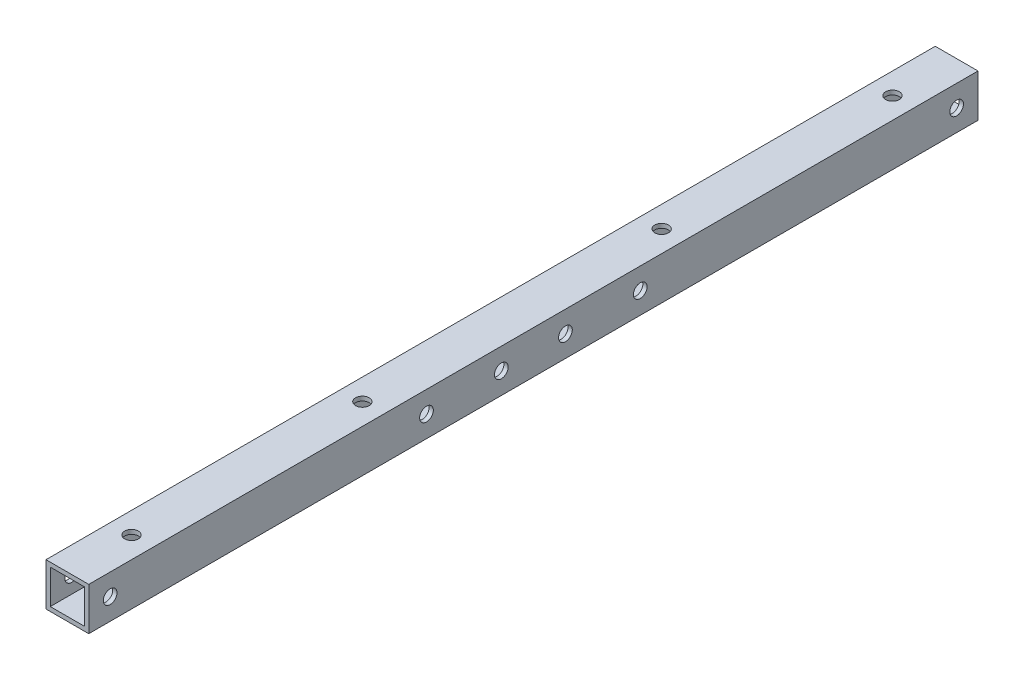
from build123d import *

# Parameters (mm, degrees)
SKETCH_1_W          = 10
SKETCH_1_H          = 10
SKETCH_1_W_2        = 8
SKETCH_1_H_2        = 8
EXTRUDE_1_DEPTH     = 208
SKETCH_2_R          = 1.6
CUT_EXTRUDE_1_DEPTH = 209.300264042
SKETCH_3_R          = 1.6
CUT_EXTRUDE_2_DEPTH = 209.300264042
SKETCH_4_R          = 1.6
CUT_EXTRUDE_3_DEPTH = 209.300264042
SKETCH_5_R          = 1.6
CUT_EXTRUDE_4_DEPTH = 209.300264042


with BuildPart() as part:
    # ｽｹｯﾁ1 → ﾎﾞｽ - 押し出し1 (new body)
    with BuildSketch(Plane.XY):
        Rectangle(SKETCH_1_W, SKETCH_1_H)
        Rectangle(SKETCH_1_W_2, SKETCH_1_H_2, mode=Mode.SUBTRACT)
    extrude(amount=EXTRUDE_1_DEPTH)

    # ｽｹｯﾁ2 → ｶｯﾄ - 押し出し1 (cut, through all)
    with BuildSketch(Plane(origin=(5, 0, 0), x_dir=(0, 0, -1), z_dir=(1, 0, 0))):
        with Locations(Location((-203, 0, 0), (0, 0, 90))):
            Circle(SKETCH_2_R)
        with Locations(Location((-111.5, 0, 0), (0, 0, 90))):
            Circle(SKETCH_2_R)
        with Locations(Location((-96.5, 0, 0), (0, 0, 90))):
            Circle(SKETCH_2_R)
        with Locations(Location((-5, 0, 0), (0, 0, 90))):
            Circle(SKETCH_2_R)
    extrude(amount=-CUT_EXTRUDE_1_DEPTH, mode=Mode.SUBTRACT)

    # ｽｹｯﾁ3 → ｶｯﾄ - 押し出し2 (cut, through all)
    with BuildSketch(Plane(origin=(0, 5, 0), x_dir=(1, 0, 0), z_dir=(0, 1, 0))):
        with Locations(Location((0, -193, 0), (0, 0, 270))):
            Circle(SKETCH_3_R)
        with Locations(Location((0, -15, 0), (0, 0, 270))):
            Circle(SKETCH_3_R)
    extrude(amount=-CUT_EXTRUDE_2_DEPTH, mode=Mode.SUBTRACT)

    # ｽｹｯﾁ4 → ｶｯﾄ - 押し出し3 (cut, through all)
    with BuildSketch(Plane(origin=(5, 0, 0), x_dir=(0, 0, -1), z_dir=(1, 0, 0))):
        with Locations(Location((-129, 0, 0), (0, 0, 90))):
            Circle(SKETCH_4_R)
        with Locations(Location((-79, 0, 0), (0, 0, 90))):
            Circle(SKETCH_4_R)
    extrude(amount=-CUT_EXTRUDE_3_DEPTH, mode=Mode.SUBTRACT)

    # ｽｹｯﾁ5 → ｶｯﾄ - 押し出し4 (cut, through all)
    with BuildSketch(Plane(origin=(0, 5, 0), x_dir=(1, 0, 0), z_dir=(0, 1, 0))):
        with Locations(Location((0, -139, 0), (0, 0, 270))):
            Circle(SKETCH_5_R)
        with Locations(Location((0, -69, 0), (0, 0, 270))):
            Circle(SKETCH_5_R)
    extrude(amount=-CUT_EXTRUDE_4_DEPTH, mode=Mode.SUBTRACT)


solid = part.part
